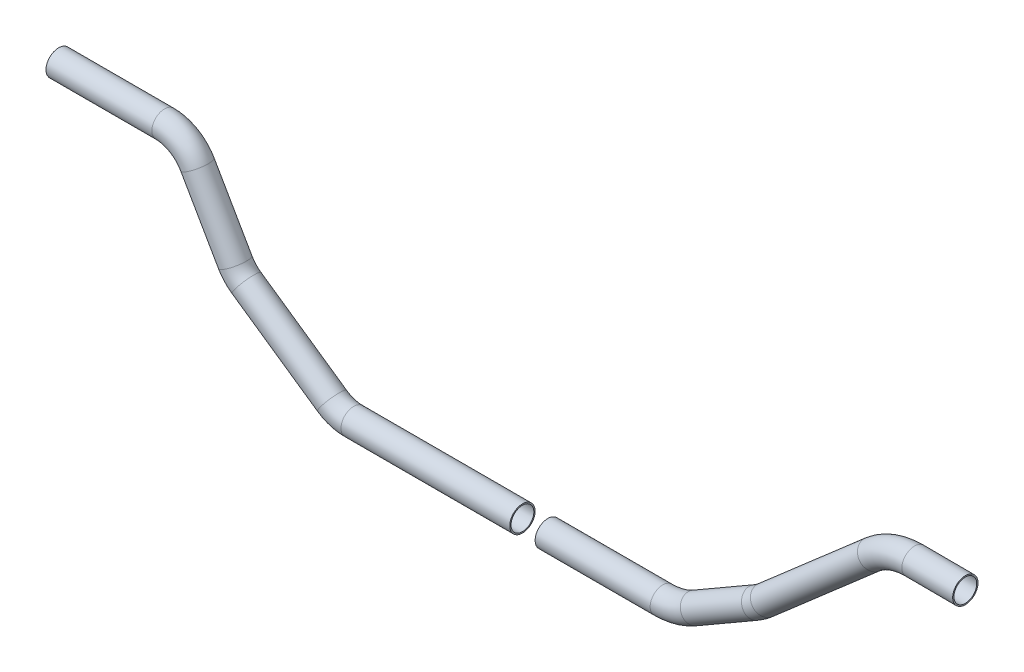
from build123d import *

# Parameters (mm, degrees)
SWEEP_THIN1_PROFILE_R   = 10
SWEEP_THIN1_PROFILE_R_2 = 9
SWEEP_THIN2_PROFILE_R   = 10
SWEEP_THIN2_PROFILE_R_2 = 9
CUT_EXTRUDE1_DEPTH      = 384.694672997
CUT_EXTRUDE1_DEPTH_BACK = 384.694672997
SKETCH39_W              = 20
SKETCH39_H              = 36.605565214


with BuildPart() as part:
    # Sweep-Thin1: sweep along a path in Sketch1
    with BuildLine(Plane.XY) as sweep_thin1_path:
        Line((30, -35.369529303), (130.719660545, -35.369529303))
        ThreePointArc((130.719660545, -35.369529303), (143.6606128, -33.665820618), (155.719660545, -28.670799492))
        Line((155.719660545, -28.670799492), (203.976681986, -0.809595173))
        ThreePointArc((203.976681986, -0.809595173), (208.019578053, 1.791427007), (211.793997814, 4.76868757))
        Line((211.793997814, 4.76868757), (296.234525798, 78.228179065))
        ThreePointArc((296.234525798, 78.228179065), (311.642095044, 87.37629918), (329.285641858, 90.50464499))
        Line((329.285641858, 90.50464499), (369.358011801, 90.317264354))
    # Sweep-Thin1 profile (on start of the path) → Sweep-Thin1 (sweep)
    with BuildSketch(Plane(origin=(30, -35.369529303, 0), x_dir=(0, 1, 0), z_dir=(1, 0, 0))):
        Circle(SWEEP_THIN1_PROFILE_R)
        Circle(SWEEP_THIN1_PROFILE_R_2, mode=Mode.SUBTRACT)
    sweep(path=sweep_thin1_path.line)

    # Sweep-Thin2: sweep along a path in Sketch2
    with BuildLine(Plane.XY) as sweep_thin2_path:
        Line((30, -35.369529303), (-113.137610077, -35.369529303))
        ThreePointArc((-113.137610077, -35.369529303), (-122.08747546, -34.003423722), (-130.222243441, -30.029523278))
        Line((-130.222243441, -30.029523278), (-197.656877086, 16.689709216))
        ThreePointArc((-197.656877086, 16.689709216), (-202.662501205, 21.051414486), (-206.586175299, 26.407301647))
        Line((-206.586175299, 26.407301647), (-236.334745336, 78.197990256))
        ThreePointArc((-236.334745336, 78.197990256), (-247.319905279, 89.219718259), (-262.348676913, 93.255588711))
        Line((-262.348676913, 93.255588711), (-345.844557131, 93.255588711))
    # Sweep-Thin2 profile (on start of the path) → Sweep-Thin2 (sweep)
    with BuildSketch(Plane(origin=(30, -35.369529303, 0), x_dir=(0, -1, 0), z_dir=(-1, 0, 0))):
        Circle(SWEEP_THIN2_PROFILE_R)
        Circle(SWEEP_THIN2_PROFILE_R_2, mode=Mode.SUBTRACT)
    sweep(path=sweep_thin2_path.line)

    # Sketch39 → Cut-Extrude1 (cut, two sides: drawn at the far end of the back side and taken through both)
    with BuildSketch(Plane.XY.offset(-CUT_EXTRUDE1_DEPTH_BACK)):
        with Locations((30, -34.132036297)):
            Rectangle(SKETCH39_W, SKETCH39_H)
    extrude(amount=CUT_EXTRUDE1_DEPTH + CUT_EXTRUDE1_DEPTH_BACK, mode=Mode.SUBTRACT)


with BuildPart() as cut_extrude1_piece_1:
    # of the separate pieces the step leaves, piece 1, a body of its own (cut_extrude1_pieces)
    add(part.part.solids().sort_by_distance((20, -45.369529303, 0))[0])


with BuildPart() as cut_extrude1_piece_2:
    # of the separate pieces the step leaves, piece 2, a body of its own (cut_extrude1_pieces)
    add(part.part.solids().sort_by_distance((40, -25.369529303, 0))[0])


solid = Compound([cut_extrude1_piece_1.part, cut_extrude1_piece_2.part])
